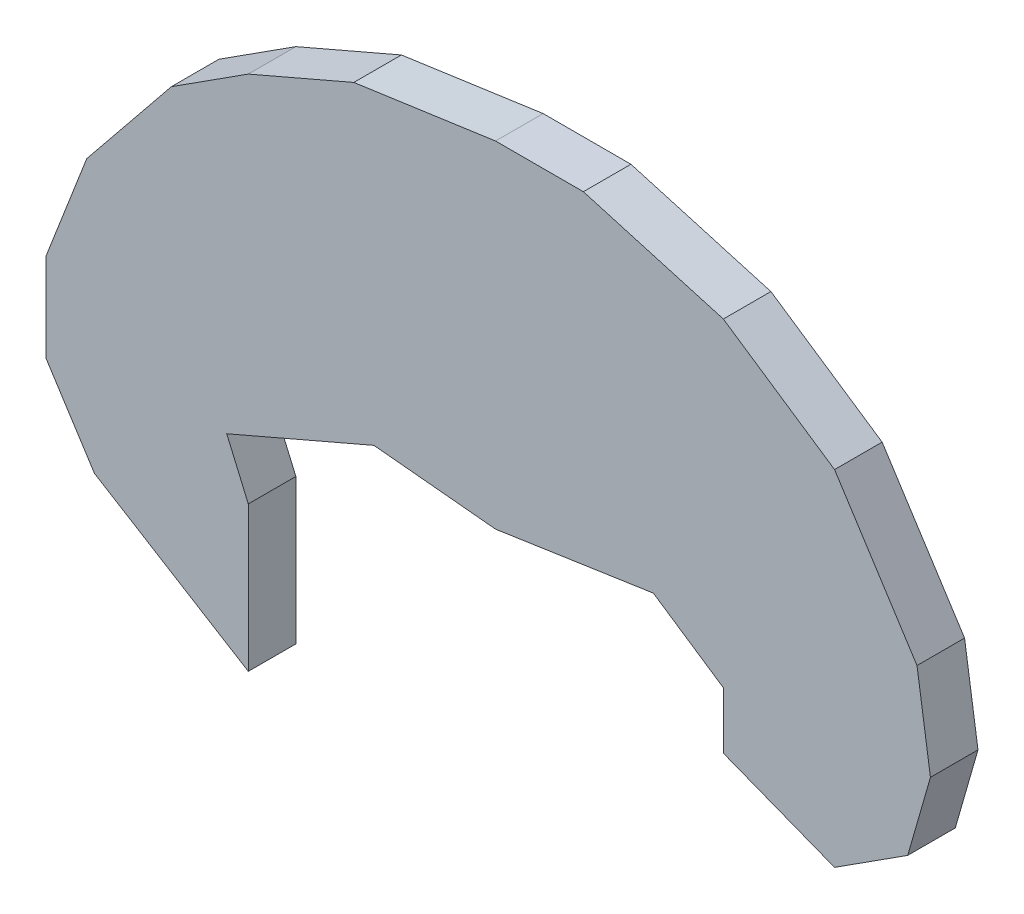
from build123d import *

# Parameters (mm, degrees)
EXTRUDE_1_DEPTH = 10


with BuildPart() as part:
    # Эскиз3 → Бобышка-Вытянуть1 (new body)
    with BuildSketch(Plane.XY):
        Polygon((-6.514300298, 57.171267059), (11.946911316, 57.171267059), (41.375784462, 48.705426839), (64.757628879, 32.983152144), (82.092444568, 5.973090489), (84.914391308, -12.974266194), (80.138601028, -29.575822882), (64.757628879, -39.447193067), (41.375784462, -30.350790899), (41.375784462, -18.424875651), (26.661347889, -8.561938093), (-6.514300298, -13.502992078), (-32.08771429, -11.032465085), (-63.03624492, -24.387833275), (-58.500314076, -34.898991983), (-58.500314076, -56.109737792), (-58.500314076, -65.387846646), (-90.852577072, -45.504364887), (-101.031994193, -29.643412629), (-101.031994193, -11.032465085), (-92.464649532, 10.989463612), (-74.676445574, 32.983152144), (-58.500314076, 43.364848478), (-36.315548637, 52.938346949), align=None)
    extrude(amount=EXTRUDE_1_DEPTH)


solid = part.part
